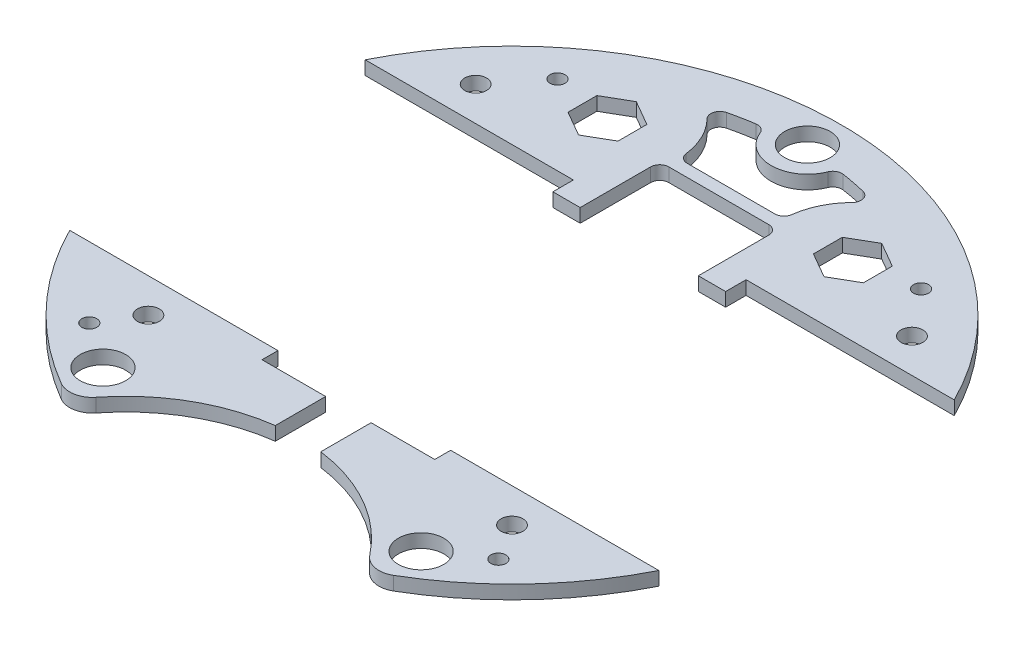
from build123d import *

# Parameters (mm, degrees)
BOSS_EXTRUDE1_DEPTH      = 3
SOLENOID_PLACEMENT_W     = 38
SOLENOID_PLACEMENT_H     = 64
CUT_EXTRUDE1_DEPTH       = 103.574363269
CUT_EXTRUDE4_DEPTH       = 103.574363269
CUT_EXTRUDE5_DEPTH       = 103.574363269
SKETCH6_R                = 2.4
CUT_EXTRUDE6_DEPTH       = 103.574363269
CUT_EXTRUDE3_DEPTH       = 103.574363269
SKETCH7_W                = 10
SKETCH7_H                = 50
CUT_EXTRUDE7_DEPTH       = 98.289516393
SKETCH9_R                = 5
CUT_EXTRUDE11_DEPTH      = 98.289516393
CUT_EXTRUDE12_DEPTH      = 98.289516393
CUT_EXTRUDE12_DEPTH_BACK = 98.289516393
SKETCH10_R               = 5
SKETCH11_R               = 1.65
CUT_EXTRUDE13_DEPTH      = 98.289516393
CUT_EXTRUDE14_DEPTH      = 98.289516393


with BuildPart() as part:
    # Sketch1 → Boss-Extrude1 (new body)
    with BuildSketch(Plane(origin=(0, 0, 0), x_dir=(1, 0, 0), z_dir=(0, 1, 0))):
        with BuildLine():
            ThreePointArc((36.543377003, -62.616544118), (0, 72.5), (-36.543377003, -62.616544118))
            ThreePointArc((-36.543377003, -62.616544118), (-33.085954668, -63.20954405), (-30.089832649, -61.38507948))
            ThreePointArc((-30.089832649, -61.38507948), (0, -46.75), (30.089832649, -61.38507948))
            ThreePointArc((30.089832649, -61.38507948), (33.085954668, -63.20954405), (36.543377003, -62.616544118))
        make_face()
    extrude(amount=BOSS_EXTRUDE1_DEPTH)

    # solenoid placement → Cut-Extrude1 (cut, through all)
    with BuildSketch(Plane(origin=(0, 3, 0), x_dir=(1, 0, 0), z_dir=(0, 1, 0))):
        with Locations((0, -4)):
            Rectangle(SOLENOID_PLACEMENT_W, SOLENOID_PLACEMENT_H)
    extrude(amount=-CUT_EXTRUDE1_DEPTH, mode=Mode.SUBTRACT)

    # Sketch4 → Cut-Extrude4 (cut, through all)
    with BuildSketch(Plane(origin=(0, 3, 0), x_dir=(1, 0, 0), z_dir=(0, 1, 0))):
        with BuildLine():
            Line((-13, 28), (13, 28))
            Line((13, 28), (13, 43.5))
            ThreePointArc((13, 43.5), (12.414213562, 44.914213562), (11, 45.5))
            Line((11, 45.5), (-11, 45.5))
            ThreePointArc((-11, 45.5), (-12.414213562, 44.914213562), (-13, 43.5))
            Line((-13, 43.5), (-13, 28))
        make_face()
    extrude(amount=-CUT_EXTRUDE4_DEPTH, mode=Mode.SUBTRACT)

    # Sketch5 → Cut-Extrude5 (cut, through all)
    with BuildSketch(Plane(origin=(0, 3, 0), x_dir=(1, 0, 0), z_dir=(0, 1, 0))):
        Polygon((-21.5, 51.175426481), (-27, 54.350852961), (-32.5, 51.175426481), (-32.5, 44.824573519), (-27, 41.649147039), (-21.5, 44.824573519), align=None)
        Polygon((21.5, 44.824573519), (21.5, 51.175426481), (27, 54.350852961), (32.5, 51.175426481), (32.5, 44.824573519), (27, 41.649147039), align=None)
    extrude(amount=-CUT_EXTRUDE5_DEPTH, mode=Mode.SUBTRACT)

    # Sketch6 → Cut-Extrude6 (cut, through all)
    with BuildSketch(Plane(origin=(0, 3, 0), x_dir=(1, 0, 0), z_dir=(0, 1, 0))):
        with Locations((40, -40)):
            Circle(SKETCH6_R)
        with Locations((-40, -40)):
            Circle(SKETCH6_R)
        with Locations((48, 40)):
            Circle(SKETCH6_R)
        with Locations((-48, 40)):
            Circle(SKETCH6_R)
    extrude(amount=-CUT_EXTRUDE6_DEPTH, mode=Mode.SUBTRACT)

    # Sketch3 → Cut-Extrude3 (cut, through all)
    with BuildSketch(Plane(origin=(0, 3, 0), x_dir=(1, 0, 0), z_dir=(0, 1, 0))):
        Polygon((-19, 28), (-19, 32.5), (-72.5, 32.5), (-72.5, -32.5), (72.5, -32.5), (72.5, 32.5), (19, 32.5), (19, 28), align=None)
    extrude(amount=-CUT_EXTRUDE3_DEPTH, mode=Mode.SUBTRACT)


with BuildPart() as cut_extrude3_piece_1:
    # of the separate pieces the step leaves, piece 1, a body of its own (cut_extrude3_pieces)
    add(part.part.solids().sort_by_distance((64.807406984, 0, -32.5))[0])

    # Sketch10 → Cut-Extrude12 (cut, two sides: drawn at the far end of the back side and taken through both)
    with BuildSketch(Plane(origin=(0, 3, 0), x_dir=(1, 0, 0), z_dir=(0, 1, 0)).offset(-CUT_EXTRUDE12_DEPTH_BACK)):
        with Locations((0, 65)):
            Circle(SKETCH10_R)
    extrude(amount=CUT_EXTRUDE12_DEPTH + CUT_EXTRUDE12_DEPTH_BACK, mode=Mode.SUBTRACT)


with BuildPart() as cut_extrude3_piece_2:
    # of the separate pieces the step leaves, piece 2, a body of its own (cut_extrude3_pieces)
    add(part.part.solids().sort_by_distance((-36.543377003, 0, 62.616544118))[0])

    # Sketch7 → Cut-Extrude7 (cut, through all)
    with BuildSketch(Plane(origin=(0, 3, 0), x_dir=(1, 0, 0), z_dir=(0, 1, 0))):
        with Locations((0, -25)):
            Rectangle(SKETCH7_W, SKETCH7_H)
    extrude(amount=-CUT_EXTRUDE7_DEPTH, mode=Mode.SUBTRACT)


with BuildPart() as cut_extrude7_piece_1:
    # of the separate pieces the step leaves, piece 1, a body of its own (cut_extrude7_pieces)
    add(cut_extrude3_piece_2.part.solids().sort_by_distance((-36.543377003, 0, 62.616544118))[0])


with BuildPart() as cut_extrude7_piece_2:
    # of the separate pieces the step leaves, piece 2, a body of its own (cut_extrude7_pieces)
    add(cut_extrude3_piece_2.part.solids().sort_by_distance((5, 0, 47.078205475))[0])


with BuildPart() as cut_extrude11_tool:
    # Sketch9 → Cut-Extrude11 (new, through all)
    with BuildSketch(Plane.XZ.offset(-3)):
        with Locations((35, 55)):
            Circle(SKETCH9_R)
        with Locations((-35, 55)):
            Circle(SKETCH9_R)
    extrude(amount=CUT_EXTRUDE11_DEPTH)


with BuildPart() as cut_extrude7_piece_1_1:
    add(cut_extrude7_piece_1.part)

    # Cut-Extrude11: cut by cut_extrude11_tool
    add(cut_extrude11_tool.part, mode=Mode.SUBTRACT)


with BuildPart() as cut_extrude7_piece_2_1:
    add(cut_extrude7_piece_2.part)

    # Cut-Extrude11: cut by cut_extrude11_tool
    add(cut_extrude11_tool.part, mode=Mode.SUBTRACT)


with BuildPart() as cut_extrude13_tool:
    # Sketch11 → Cut-Extrude13 (new, through all)
    with BuildSketch(Plane(origin=(0, 3, 0), x_dir=(1, 0, 0), z_dir=(0, 1, 0))):
        with Locations((45, -48)):
            Circle(SKETCH11_R)
        with Locations((-45, -48)):
            Circle(SKETCH11_R)
        with Locations((40, 50)):
            Circle(SKETCH11_R)
        with Locations((-40, 50)):
            Circle(SKETCH11_R)
    extrude(amount=-CUT_EXTRUDE13_DEPTH)


with BuildPart() as cut_extrude3_piece_1_1:
    add(cut_extrude3_piece_1.part)

    # Cut-Extrude13: cut by cut_extrude13_tool
    add(cut_extrude13_tool.part, mode=Mode.SUBTRACT)

    # Sketch13 → Cut-Extrude14 (cut, through all)
    with BuildSketch(Plane(origin=(0, 3, 0), x_dir=(1, 0, 0), z_dir=(0, 1, 0))):
        with BuildLine():
            ThreePointArc((-11.622969422, 49.948571429), (-10.961172041, 48.699523885), (-9.638836445, 48.2))
            Line((-9.638836445, 48.2), (9.638836445, 48.2))
            ThreePointArc((9.638836445, 48.2), (10.961172041, 48.699523885), (11.622969422, 49.948571429))
            ThreePointArc((11.622969422, 49.948571429), (13.054510917, 54.765599326), (15.951885484, 58.871484058))
            ThreePointArc((15.951885484, 58.871484058), (16.449270482, 60.8240474), (14.994913363, 62.21858704))
            ThreePointArc((14.994913363, 62.21858704), (12.303854546, 62.806171379), (9.590005203, 63.277419355))
            ThreePointArc((9.590005203, 63.277419355), (8.295362524, 63.03495375), (7.432254032, 62.04))
            ThreePointArc((7.432254032, 62.04), (0, 57), (-7.432254032, 62.04))
            ThreePointArc((-7.432254032, 62.04), (-8.295362524, 63.03495375), (-9.590005203, 63.277419355))
            ThreePointArc((-9.590005203, 63.277419355), (-12.303854546, 62.806171379), (-14.994913363, 62.21858704))
            ThreePointArc((-14.994913363, 62.21858704), (-16.449270482, 60.8240474), (-15.951885484, 58.871484058))
            ThreePointArc((-15.951885484, 58.871484058), (-13.054510917, 54.765599326), (-11.622969422, 49.948571429))
        make_face()
    extrude(amount=-CUT_EXTRUDE14_DEPTH, mode=Mode.SUBTRACT)


with BuildPart() as cut_extrude7_piece_1_2:
    add(cut_extrude7_piece_1_1.part)

    # Cut-Extrude13: cut by cut_extrude13_tool
    add(cut_extrude13_tool.part, mode=Mode.SUBTRACT)


with BuildPart() as cut_extrude7_piece_2_2:
    add(cut_extrude7_piece_2_1.part)

    # Cut-Extrude13: cut by cut_extrude13_tool
    add(cut_extrude13_tool.part, mode=Mode.SUBTRACT)


solid = Compound([cut_extrude3_piece_1_1.part, cut_extrude7_piece_1_2.part, cut_extrude7_piece_2_2.part])
